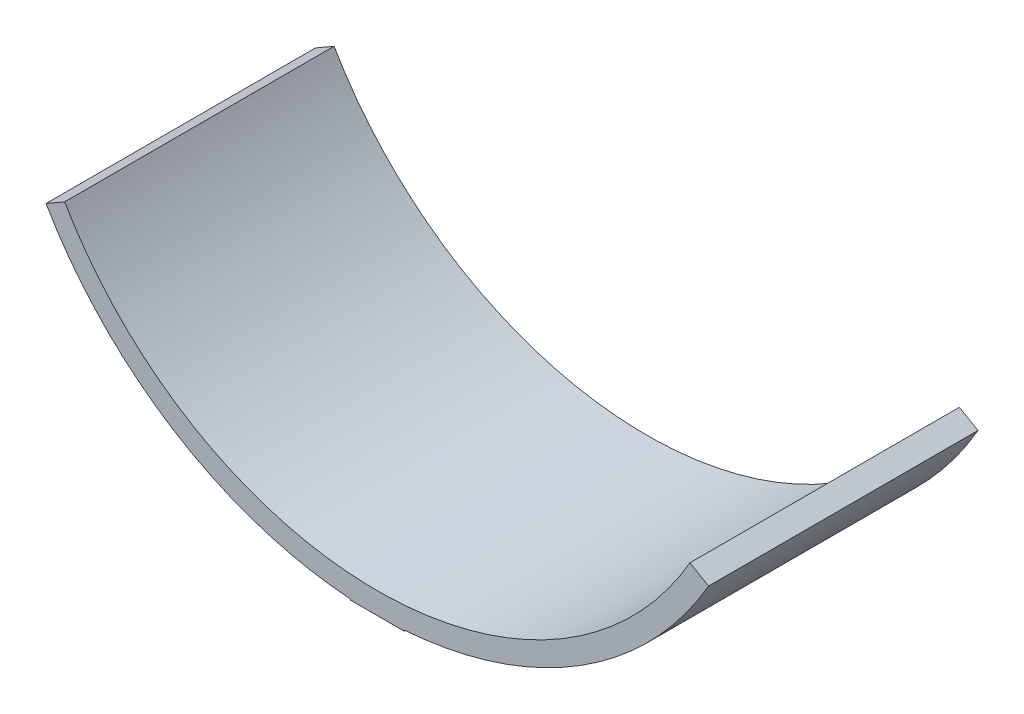
from build123d import *

# Parameters (mm, degrees)
SKETCH1_W           = 12.7
SKETCH1_H           = 5.08
BOSS_EXTRUDE1_DEPTH = 63.5


with BuildPart() as part:
    # Sketch1 → Boss-Extrude1 (new body)
    with BuildSketch(Plane.XY):
        Rectangle(SKETCH1_W, SKETCH1_H)
        with BuildLine():
            Line((-73.690101608, 45.085), (-78.089510659, 42.545))
            ThreePointArc((-78.089510659, 42.545), (0, -2.54), (78.089510659, 42.545))
            Line((78.089510659, 42.545), (73.690101608, 45.085))
            ThreePointArc((73.690101608, 45.085), (0, 2.54), (-73.690101608, 45.085))
        make_face()
    extrude(amount=BOSS_EXTRUDE1_DEPTH)


solid = part.part
